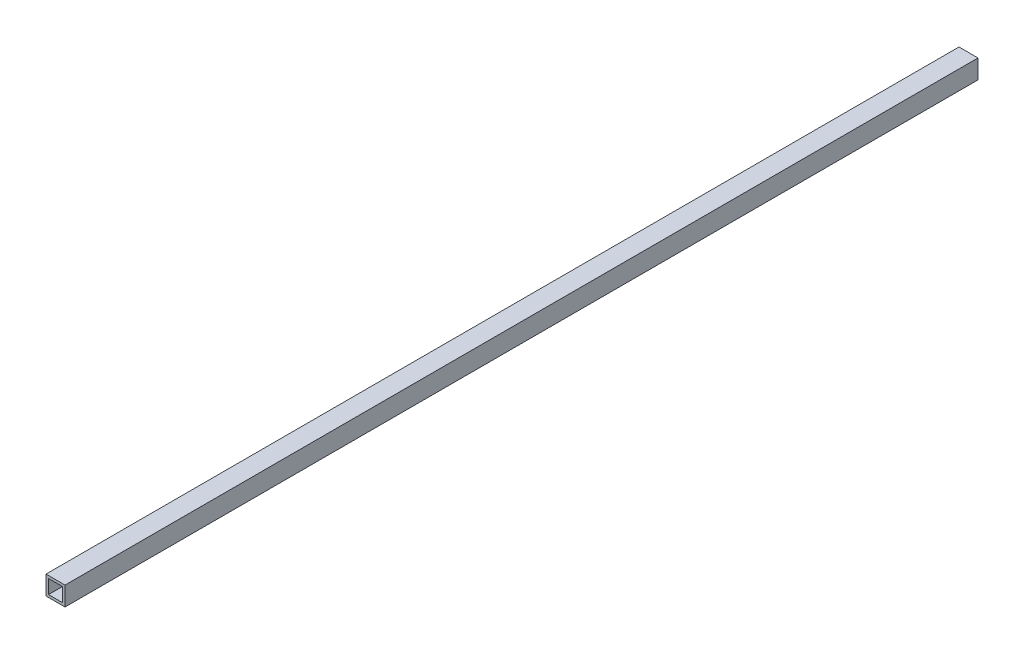
from build123d import *

# Parameters (mm, degrees)
SKETCH1_W           = 12.7
SKETCH1_H           = 12.7
SKETCH1_W_2         = 9.3
SKETCH1_H_2         = 9.3
BOSS_EXTRUDE1_DEPTH = 304.8


with BuildPart() as part:
    # Sketch1 → Boss-Extrude1 (new, symmetric)
    with BuildSketch(Plane.XY):
        Rectangle(SKETCH1_W, SKETCH1_H)
        Rectangle(SKETCH1_W_2, SKETCH1_H_2, mode=Mode.SUBTRACT)
    extrude(amount=BOSS_EXTRUDE1_DEPTH, both=True)


solid = part.part
